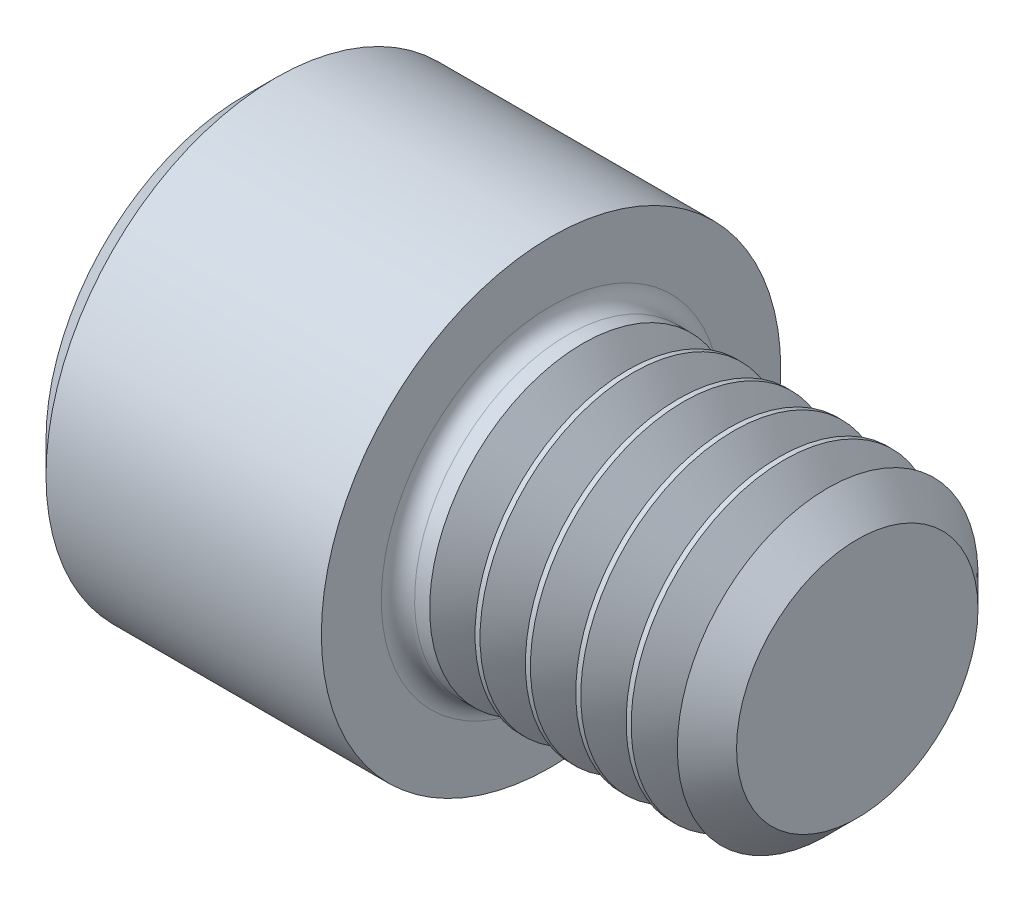
from build123d import *

# Parameters (mm, degrees)
FILLET1_R       = 0.4318
HEX_2_DEPTH     = 3.8354
THDSCHPAT_COUNT = 5
THDSCHPAT_PITCH = 1.30556


with BuildPart() as part:
    # BodySke → Base-Revolve (revolve)
    with BuildSketch(Plane.XY, mode=Mode.PRIVATE) as base_revolve_sk:
        Polygon((0, 0), (0, 5.15366), (0.8001, 5.95376), (7.9375, 5.95376), (7.9375, 3.96875), (15.03553, 3.96875), (15.875, 3.12928), (15.875, 0), align=None)
    revolve(base_revolve_sk.sketch.rotate(Axis((-31.75, 0, 0), (1, 0, 0)), 90), axis=Axis((-31.75, 0, 0), (1, 0, 0)))

    # Fillet1
    fillet1_edges = [part.edges().sort_by_distance(p)[0] for p in [
        (7.9375, 0, -3.96875),
    ]]
    fillet(fillet1_edges, radius=FILLET1_R)

    # Sketch2 → Hex-PreBroach (revolve, cut)
    with BuildSketch(Plane.XY, mode=Mode.PRIVATE) as hex_prebroach_sk:
        Polygon((0, 3.175), (3.8354, 3.175), (5.668487105, 0), (0, 0), align=None)
    revolve(hex_prebroach_sk.sketch.rotate(Axis((0, 0, 0), (1, 0, 0)), 90), axis=Axis((0, 0, 0), (1, 0, 0)), mode=Mode.SUBTRACT)

    # Sketch3 → Hex 2 (cut)
    with BuildSketch(Plane(origin=(0, 0, 0), x_dir=(0, 0.500000000000001, 0.866025403784438), z_dir=(-1, 0, 0))):
        Polygon((1.833087105, 3.175), (-1.833087105, 3.175), (-3.666174209, 0), (-1.833087105, -3.175), (1.833087105, -3.175), (3.666174209, 0), align=None)
    extrude(amount=-HEX_2_DEPTH, mode=Mode.SUBTRACT)

    # ThdSchSke → ThreadSchematic (revolve, cut)
    with BuildSketch(Plane.XY):
        Polygon((9.3472, -3.12928), (8.759396778, -3.96875), (8.759396778, -4.9609375), (9.935003222, -4.9609375), (9.935003222, -3.96875), align=None)
    threadschematic = revolve(axis=Axis((-3.175, 0, 0), (1, 0, 0)), mode=Mode.SUBTRACT)

    # ThdSchPat: ThreadSchematic ×5
    with Locations(*[(i * THDSCHPAT_PITCH, 0, 0) for i in range(1, THDSCHPAT_COUNT)]):
        add(threadschematic, mode=Mode.SUBTRACT)


solid = part.part
